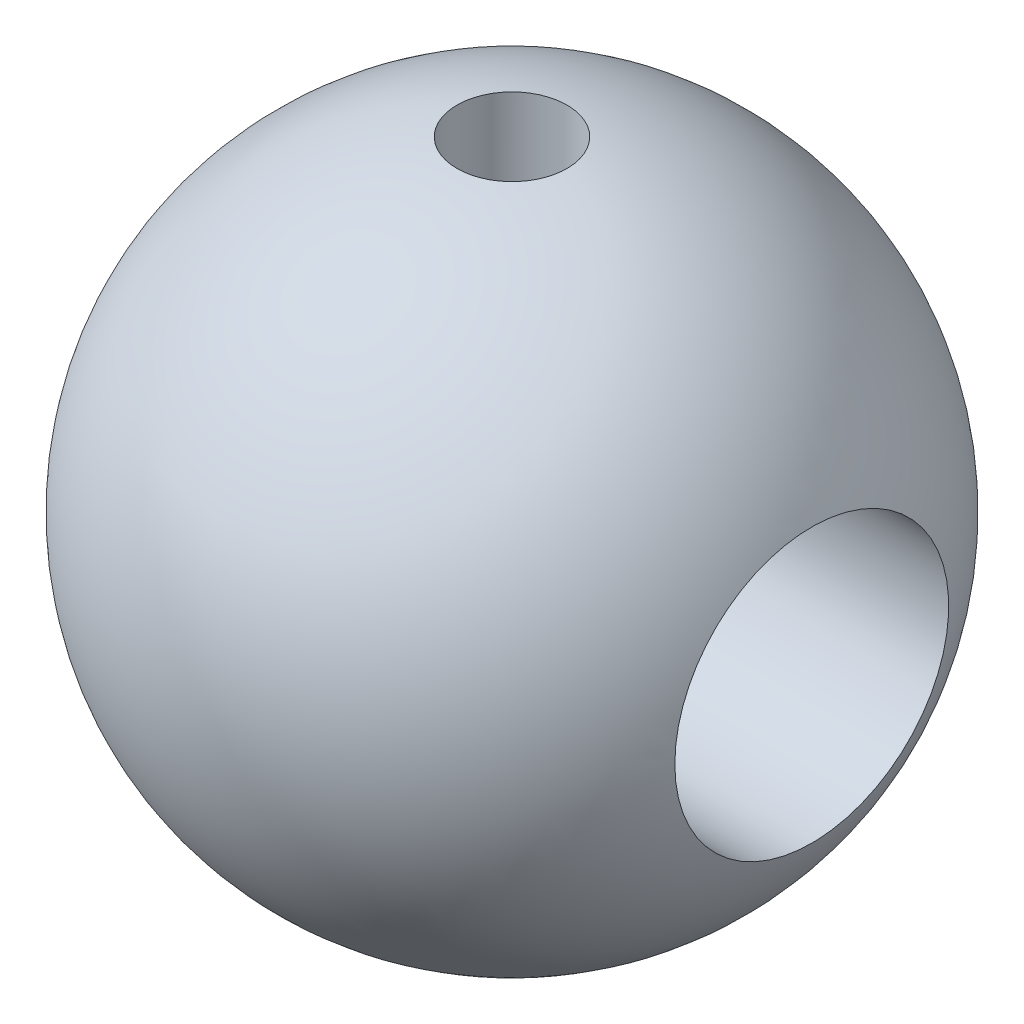
from build123d import *

# Parameters (mm, degrees)
SKETCH2_W = 26.852940898
SKETCH2_H = 3.96


with BuildPart() as part:
    # Sketch1 → Revolve1 (revolve)
    with BuildSketch(Plane(origin=(0, 0, 0), x_dir=(0, 0, -1), z_dir=(1, 0, 0))):
        with BuildLine():
            Line((1.59, 9.396424852), (1.59, -9.396424852))
            ThreePointArc((1.59, -9.396424852), (9.53, 0), (1.59, 9.396424852))
        make_face()
    revolve(axis=Axis((0, 11.528042045, 0), (0, -1, 0)))

    # Sketch2 → Cut-Revolve1 (revolve, cut)
    with BuildSketch(Plane.XY, mode=Mode.PRIVATE) as cut_revolve1_sk:
        with Locations((0.631338736, 1.98)):
            Rectangle(SKETCH2_W, SKETCH2_H)
    revolve(cut_revolve1_sk.sketch.rotate(Axis((-12.795131713, 0, 0), (1, 0, 0)), 90), axis=Axis((-12.795131713, 0, 0), (1, 0, 0)), mode=Mode.SUBTRACT)


solid = part.part
